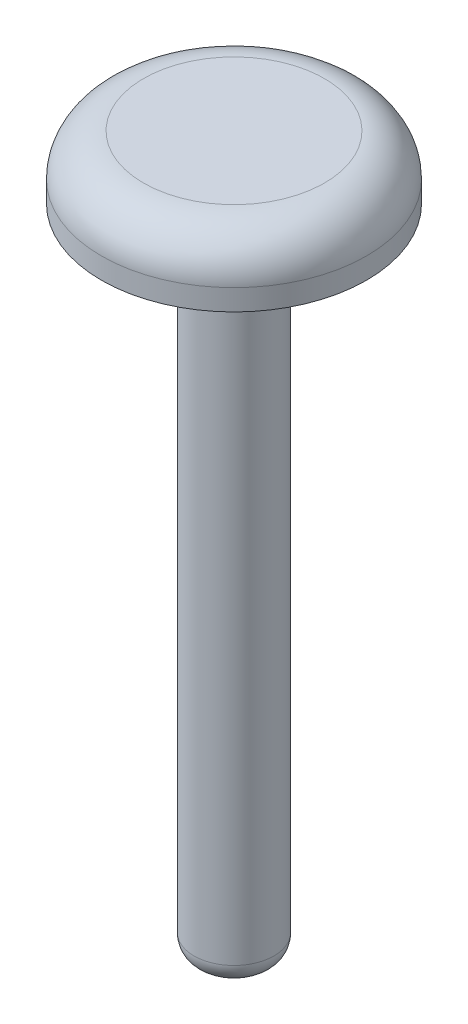
from build123d import *
from build123d.topology import SkipClean

# Parameters (mm, degrees)
CROQUIS1_R                   = 0.95
SALIENTE_EXTRUIR1_DEPTH      = 17
SALIENTE_EXTRUIR2_DEPTH      = 0.0001
SALIENTE_EXTRUIR2_DEPTH_BACK = 1.5
CROQUIS2_R                   = 3.15
REDONDEO3_R                  = 0.5
REDONDEO5_R                  = 1
CROQUIS4_R                   = 2.65
CROQUIS4_R_2                 = 0.95
CORTAR_EXTRUIR4_DEPTH        = 1


with BuildPart() as part:
    # Croquis1 → Saliente-Extruir1 (new body)
    with BuildSketch(Plane(origin=(0, 0, 0), x_dir=(1, 0, 0), z_dir=(0, 1, 0))):
        with Locations(Location((0, 0, 0), (0, 0, 270))):
            Circle(CROQUIS1_R)
    extrude(amount=SALIENTE_EXTRUIR1_DEPTH)

    # Croquis2 → Saliente-Extruir2 (add, two sides: drawn at the far end of the back side and taken through both)
    with BuildSketch(Plane(origin=(0, 17, 0), x_dir=(1, 0, 0), z_dir=(0, 1, 0)).offset(-SALIENTE_EXTRUIR2_DEPTH_BACK)):
        with Locations(Location((0, 0, 0), (0, 0, 270))):
            Circle(CROQUIS2_R)
    extrude(amount=SALIENTE_EXTRUIR2_DEPTH + SALIENTE_EXTRUIR2_DEPTH_BACK)

    # Redondeo3
    redondeo3_edges = [part.edges().sort_by_distance(p)[0] for p in [
        (0, 0, -0.95),
    ]]
    fillet(redondeo3_edges, radius=REDONDEO3_R)

    # Redondeo5
    redondeo5_edges = [part.edges().sort_by_distance(p)[0] for p in [
        (0, 17.0001, -3.15),
    ]]
    fillet(redondeo5_edges, radius=REDONDEO5_R)

    # Croquis4 → Cortar-Extruir4 (cut)
    with SkipClean():  # the faces are left unmerged after this step: merging them gives an invalid solid
        with BuildSketch(Plane(origin=(0, 15.5, 0), x_dir=(-1, 0, 0), z_dir=(0, -1, 0))):
            with Locations(Location((0, 0, 0), (0, 0, 90))):
                Circle(CROQUIS4_R)
            with Locations(Location((0, 0, 0), (0, 0, 90))):
                Circle(CROQUIS4_R_2, mode=Mode.SUBTRACT)
        extrude(amount=-CORTAR_EXTRUIR4_DEPTH, mode=Mode.SUBTRACT)


solid = part.part
